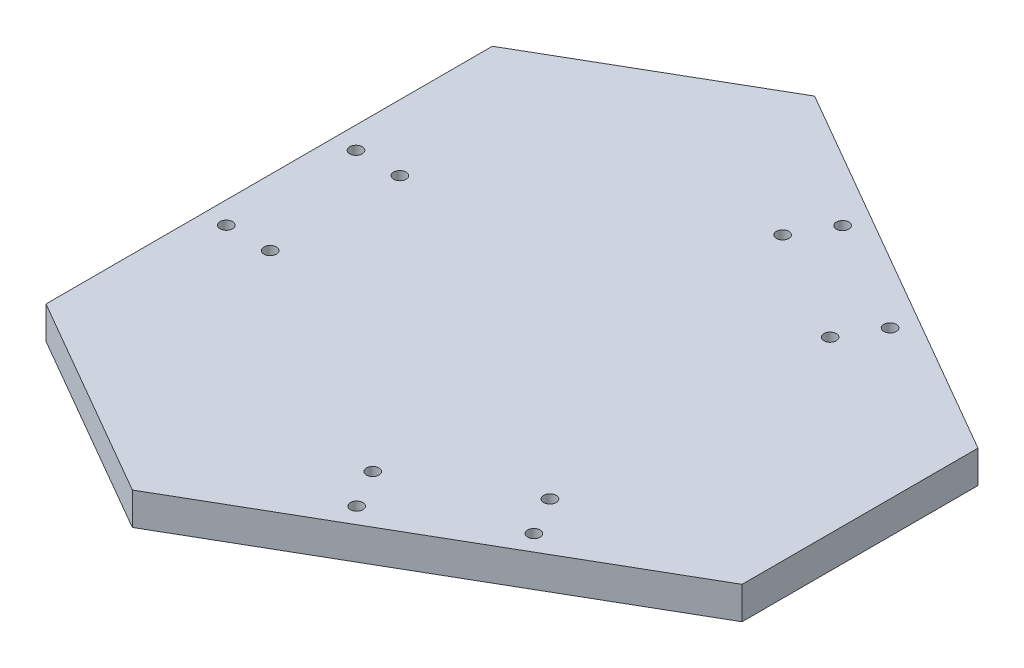
from build123d import *

# Parameters (mm, degrees)
SKETCH2_R           = 2.4511
BOSS_EXTRUDE1_DEPTH = 12.7


with BuildPart() as part:
    # Sketch2 → Boss-Extrude1 (new body)
    with BuildSketch(Plane(origin=(0, 0, 0), x_dir=(1, 0, 0), z_dir=(0, 1, 0))):
        Polygon((127.583980757, 46.188021535), (127.583980757, -46.188021535), (-23.791990378, -133.584979219), (-103.791990378, -87.396957684), (-103.791990378, 87.396957684), (-23.791990378, 133.584979219), align=None)
        with Locations(Location((69.596393923, -69.745175923, 0), (0, 0, 270))):
            Circle(SKETCH2_R, mode=Mode.SUBTRACT)
        with Locations(Location((25.602897179, -95.144833111, 0), (0, 0, 90))):
            Circle(SKETCH2_R, mode=Mode.SUBTRACT)
        with Locations(Location((60.999643199, -54.855166889, 0), (0, 0, 90))):
            Circle(SKETCH2_R, mode=Mode.SUBTRACT)
        with Locations(Location((17.006146456, -80.254824077, 0), (0, 0, 270))):
            Circle(SKETCH2_R, mode=Mode.SUBTRACT)
        with Locations(Location((-78.005789655, -25.399657187, 0), (0, 0, 90))):
            Circle(SKETCH2_R, mode=Mode.SUBTRACT)
        with Locations(Location((-95.199291102, -25.399657187, 0), (0, 0, 270))):
            Circle(SKETCH2_R, mode=Mode.SUBTRACT)
        with Locations(Location((-95.199291102, 25.399657187, 0), (0, 0, 90))):
            Circle(SKETCH2_R, mode=Mode.SUBTRACT)
        with Locations(Location((-78.005789655, 25.399657187, 0), (0, 0, 270))):
            Circle(SKETCH2_R, mode=Mode.SUBTRACT)
        with Locations(Location((60.999643199, 54.855166889, 0), (0, 0, 270))):
            Circle(SKETCH2_R, mode=Mode.SUBTRACT)
        with Locations(Location((69.596393923, 69.745175923, 0), (0, 0, 90))):
            Circle(SKETCH2_R, mode=Mode.SUBTRACT)
        with Locations(Location((25.602897179, 95.144833111, 0), (0, 0, 270))):
            Circle(SKETCH2_R, mode=Mode.SUBTRACT)
        with Locations(Location((17.006146456, 80.254824077, 0), (0, 0, 90))):
            Circle(SKETCH2_R, mode=Mode.SUBTRACT)
    extrude(amount=BOSS_EXTRUDE1_DEPTH)


solid = part.part
